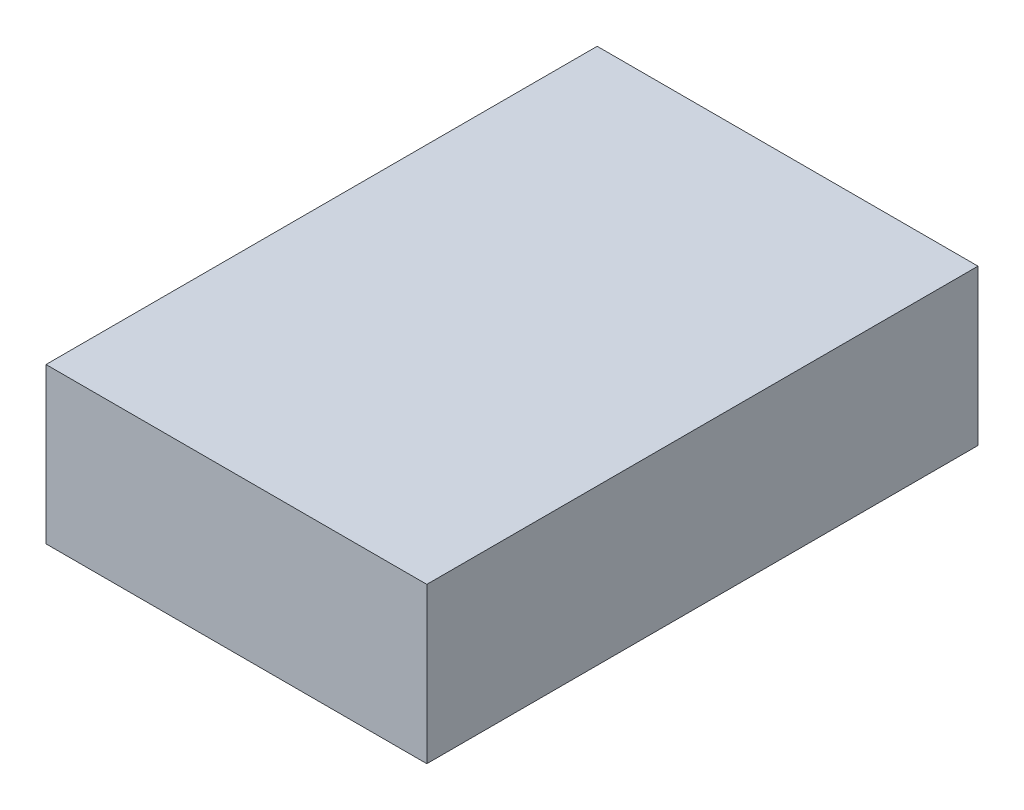
from build123d import *

# Parameters (mm, degrees)
SKETCH1_W           = 38
SKETCH1_H           = 55
BOSS_EXTRUDE1_DEPTH = 15.4999944


with BuildPart() as part:
    # Sketch1 → Boss-Extrude1 (new body)
    with BuildSketch(Plane(origin=(0, 0, 0), x_dir=(1, 0, 0), z_dir=(0, 1, 0))):
        Rectangle(SKETCH1_W, SKETCH1_H)
    extrude(amount=BOSS_EXTRUDE1_DEPTH)


solid = part.part
